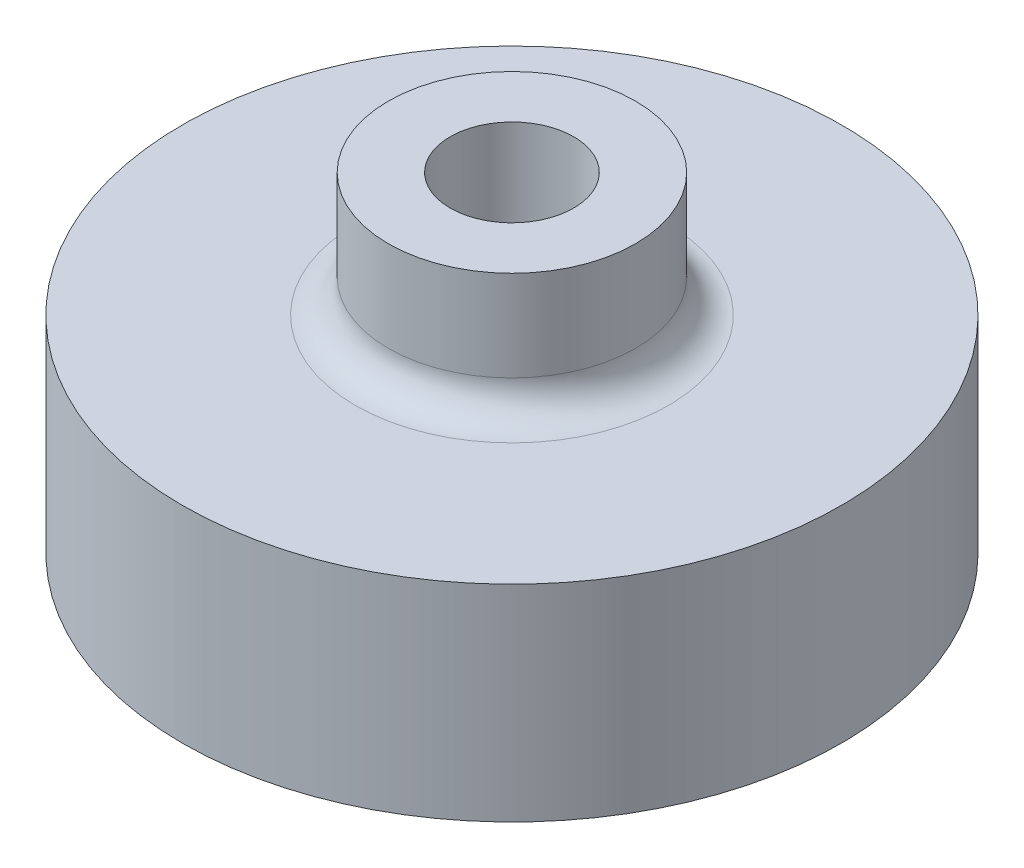
from build123d import *

# Parameters (mm, degrees)
SKETCH1_R           = 1000
BOSS_EXTRUDE1_DEPTH = 625
SKETCH2_R           = 375
BOSS_EXTRUDE2_DEPTH = 375
FILLET1_R           = 100
SKETCH3_R           = 187.5
CUT_EXTRUDE1_DEPTH  = 875
CUT_EXTRUDE2_START  = -125
CUT_EXTRUDE2_DEPTH  = 125


with BuildPart() as part:
    # Sketch1 → Boss-Extrude1 (new body)
    with BuildSketch(Plane(origin=(0, 0, 0), x_dir=(1, 0, 0), z_dir=(0, 1, 0))):
        with Locations(Location((0, 0, 0), (0, 0, 270))):
            Circle(SKETCH1_R)
    extrude(amount=BOSS_EXTRUDE1_DEPTH)

    # Sketch2 → Boss-Extrude2 (add)
    with BuildSketch(Plane(origin=(0, 625, 0), x_dir=(1, 0, 0), z_dir=(0, 1, 0))):
        with Locations(Location((0, 0, 0), (0, 0, 270))):
            Circle(SKETCH2_R)
    extrude(amount=BOSS_EXTRUDE2_DEPTH)

    # Fillet1
    fillet1_edges = [part.edges().sort_by_distance(p)[0] for p in [
        (0, 625, -375),
    ]]
    fillet(fillet1_edges, radius=FILLET1_R)

    # Sketch3 → Cut-Extrude1 (cut)
    with BuildSketch(Plane(origin=(0, 1000, 0), x_dir=(1, 0, 0), z_dir=(0, 1, 0))):
        with Locations(Location((0, 0, 0), (0, 0, 270))):
            Circle(SKETCH3_R)
    extrude(amount=-CUT_EXTRUDE1_DEPTH, mode=Mode.SUBTRACT)

    # Sketch4 → Cut-Extrude2 (cut)
    with BuildSketch(Plane(origin=(0, 0, 0), x_dir=(-1, 0, 0), z_dir=(0, -1, 0)).offset(CUT_EXTRUDE2_START)):
        with BuildLine():
            Line((50, 180.710403685), (50, -180.710403685))
            ThreePointArc((50, -180.710403685), (187.5, 0), (50, 180.710403685))
        make_face()
        with BuildLine():
            ThreePointArc((-48.087593772, 181.228676884), (-187.5, 0), (-48.087593772, -181.228676884))
            Line((-48.087593772, -181.228676884), (-48.087593772, 181.228676884))
        make_face()
    extrude(amount=CUT_EXTRUDE2_DEPTH, mode=Mode.SUBTRACT)


solid = part.part
